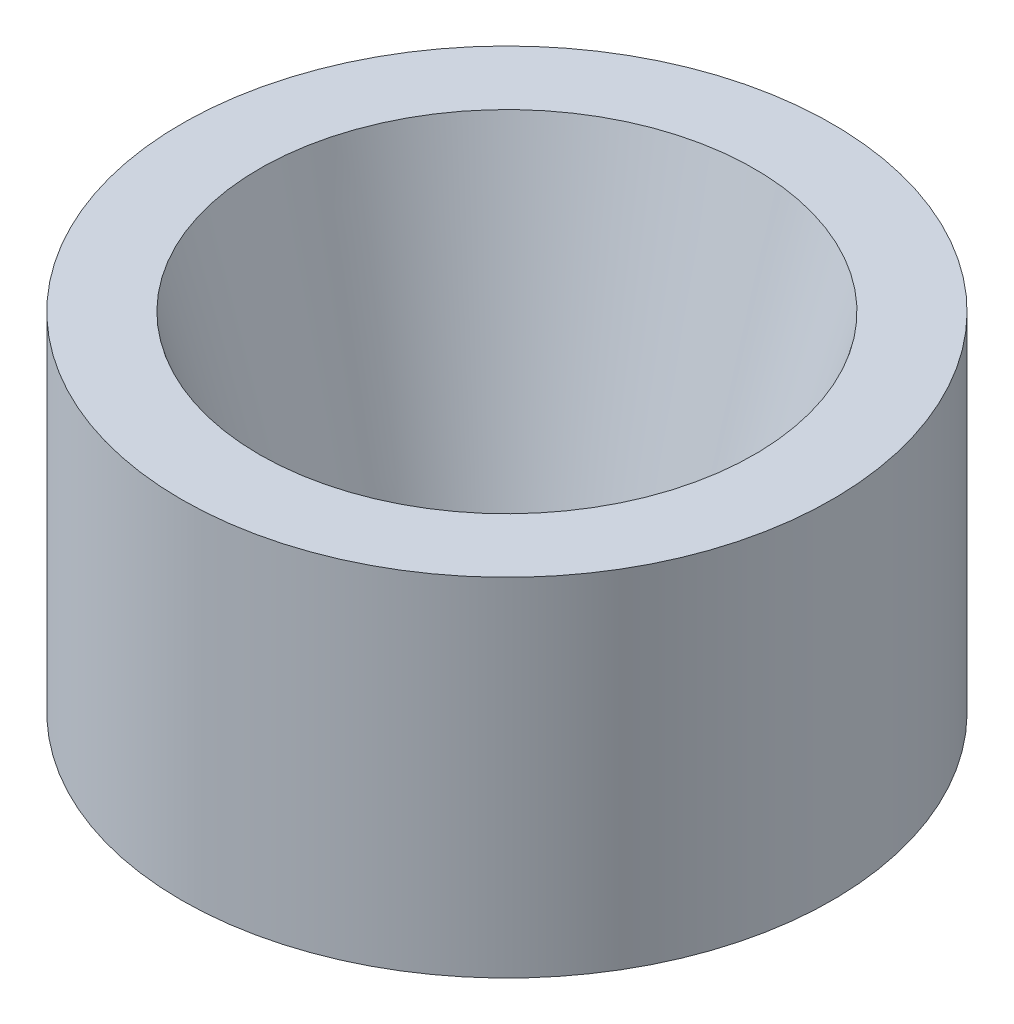
from build123d import *


with BuildPart() as part:
    # Esquisse1 → Révolution1 (revolve)
    with BuildSketch(Plane.XY, mode=Mode.PRIVATE) as r_volution1_sk:
        Polygon((-5.705727468, 0), (-3.802713358, -7.102145346), (-3.802713358, -8), (-7.5, -8), (-7.5, 0), align=None)
    revolve(r_volution1_sk.sketch.rotate(Axis((0, 0, 0), (0, -1, 0)), 270), axis=Axis((0, 0, 0), (0, -1, 0)))


solid = part.part
